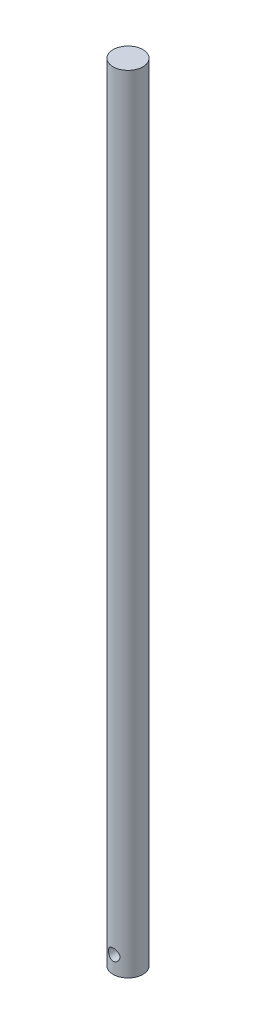
from build123d import *

# Parameters (mm, degrees)
SKETCH1_R               = 13
BOSS_EXTRUDE1_DEPTH     = 685
CUT_EXTRUDE1_DEPTH      = 686.246670915
CUT_EXTRUDE1_DEPTH_BACK = 686.246670915
SKETCH2_R               = 5


with BuildPart() as part:
    # Sketch1 → Boss-Extrude1 (new body)
    with BuildSketch(Plane(origin=(0, 0, 0), x_dir=(1, 0, 0), z_dir=(0, 1, 0))):
        with Locations(Location((0, 0, 0), (0, 0, 270))):
            Circle(SKETCH1_R)
    extrude(amount=BOSS_EXTRUDE1_DEPTH)

    # Sketch2 → Cut-Extrude1 (cut, two sides: drawn at the far end of the back side and taken through both)
    with BuildSketch(Plane.XY.offset(-CUT_EXTRUDE1_DEPTH_BACK)):
        with Locations(Location((0, 15, 0), (0, 0, 90))):
            Circle(SKETCH2_R)
    extrude(amount=CUT_EXTRUDE1_DEPTH + CUT_EXTRUDE1_DEPTH_BACK, mode=Mode.SUBTRACT)


solid = part.part
